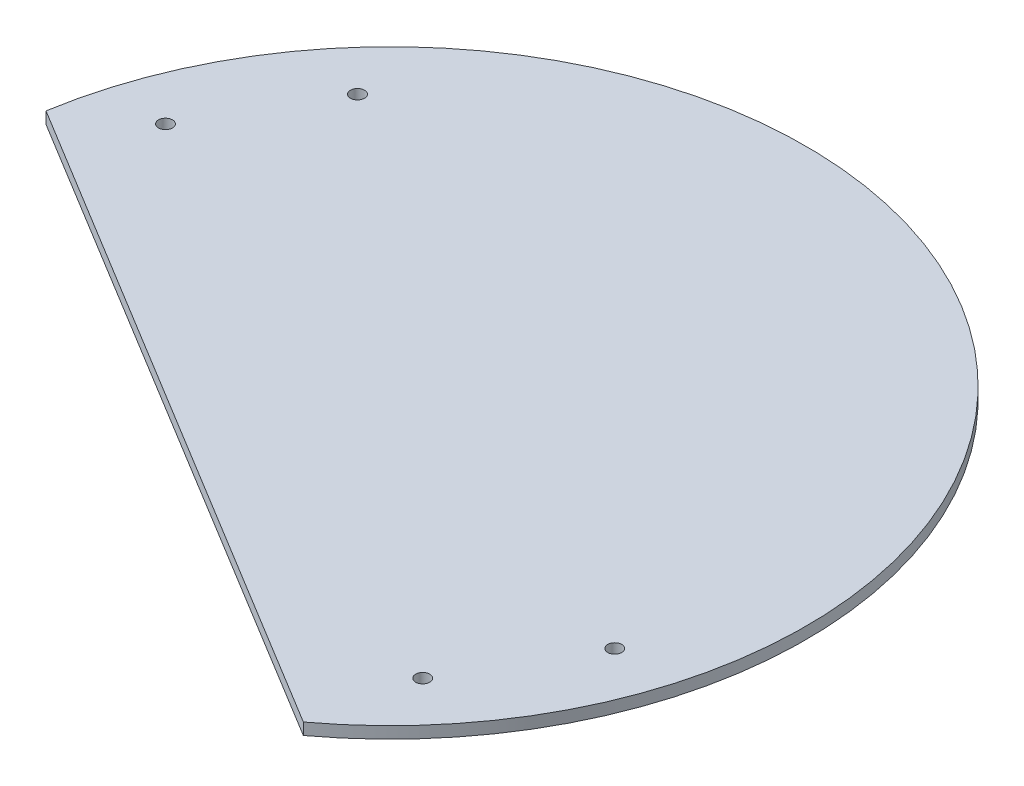
from build123d import *

# Parameters (mm, degrees)
SKETCH_1_R      = 3
EXTRUDE_1_DEPTH = 5


with BuildPart() as part:
    # 草图1 → 凸台-拉伸1 (new body)
    with BuildSketch(Plane(origin=(0, 0, 0), x_dir=(1, 0, 0), z_dir=(0, 1, 0))):
        with BuildLine():
            Line((-39.885379482, -89.051728746), (240.960836827, -260.037504895))
            ThreePointArc((240.960836827, -260.037504895), (227.643725358, 34.228528193), (-39.885379482, -89.051728746))
        make_face()
        with Locations(Location((20.435189142, -16.402343887, 0), (0, 0, 270))):
            Circle(SKETCH_1_R, mode=Mode.SUBTRACT)
        with Locations(Location((-9.564810858, -68.363868114, 0), (0, 0, 270))):
            Circle(SKETCH_1_R, mode=Mode.SUBTRACT)
        with Locations(Location((250.242810277, -218.363868114, 0), (0, 0, 270))):
            Circle(SKETCH_1_R, mode=Mode.SUBTRACT)
        with Locations(Location((280.242810277, -166.402343887, 0), (0, 0, 270))):
            Circle(SKETCH_1_R, mode=Mode.SUBTRACT)
    extrude(amount=EXTRUDE_1_DEPTH)


solid = part.part
